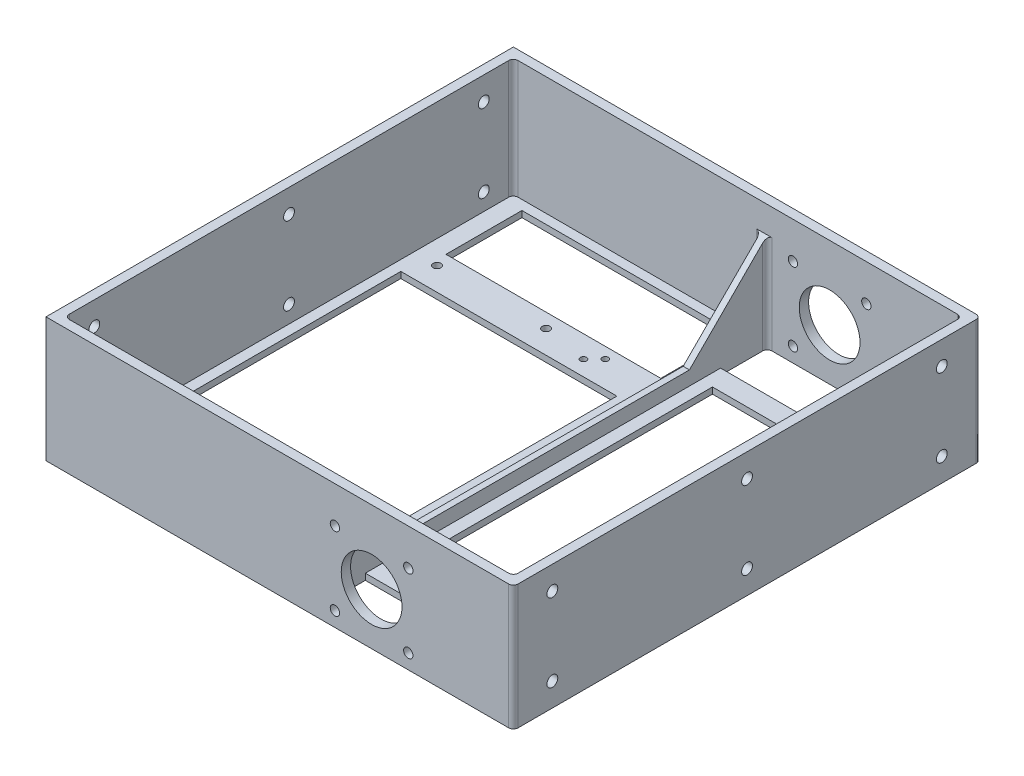
from build123d import *

# Parameters (mm, degrees)
SKETCH_1_W                = 300
SKETCH_1_H                = 300
EXTRUDE_1_DEPTH           = 4
EXTRUDE_2_DEPTH           = 76
FILLET_1_R                = 3
CUT_EXTRUDE_1_DEPTH       = 345.818792991
CUT_EXTRUDE_1_DEPTH_BACK  = 345.818792991
SKETCH_3_R                = 3
SKETCH_3_R_2              = 19.5
SKETCH_4_W                = 6
SKETCH_4_H                = 300
EXTRUDE_3_DEPTH           = 76
SKETCH_7_R                = 2
CUT_EXTRUDE_3_DEPTH       = 10
SKETCH_14_W               = 80
SKETCH_14_H               = 30
CUT_EXTRUDE_9_DEPTH       = 20
CUT_EXTRUDE_10_DEPTH      = 345.818792991
CUT_EXTRUDE_10_DEPTH_BACK = 345.818792991
SKETCH_15_R               = 3.5
SKETCH_16_W               = 4
SKETCH_16_H               = 288
EXTRUDE_5_DEPTH           = 9
CHAMFER_3_SIZE            = 50
SKETCH_17_R               = 2.25
SKETCH_17_R_2             = 2.5
CUT_EXTRUDE_11_DEPTH      = 6
SKETCH_18_W               = 137.872576177
SKETCH_18_H               = 47.95567867
SKETCH_18_W_2             = 92.314681441
SKETCH_18_H_2             = 203.212188366
SKETCH_18_W_3             = 138.671837489
SKETCH_18_H_3             = 133.676454294
SKETCH_18_H_4             = 48.754939981
CUT_EXTRUDE_12_DEPTH      = 6
FILLET_4_R                = 3


with BuildPart() as part:
    # Эскиз1 → Бобышка-Вытянуть1 (new body)
    with BuildSketch(Plane(origin=(0, 0, 0), x_dir=(1, 0, 0), z_dir=(0, 1, 0))):
        Rectangle(SKETCH_1_W, SKETCH_1_H)
    extrude(amount=EXTRUDE_1_DEPTH)

    # Эскиз2 → Бобышка-Вытянуть2 (add)
    with BuildSketch(Plane(origin=(0, 4, 0), x_dir=(1, 0, 0), z_dir=(0, 1, 0))):
        Polygon((150, 150), (-144, 150), (-144, 144), (144, 144), (144, -144), (-144, -144), (-144, -150), (150, -150), (150, 0.239524614), align=None)
    extrude(amount=EXTRUDE_2_DEPTH)

    # Скругление1
    fillet_1_edges = [part.edges().sort_by_distance(p)[0] for p in [
        (150, 40, 150),
        (150, 40, -150),
    ]]
    fillet(fillet_1_edges, radius=FILLET_1_R)

    # Эскиз3 → Вырез-Вытянуть1 (cut, two sides: drawn at the far end of the back side and taken through both)
    with BuildSketch(Plane.XY.offset(150).offset(-CUT_EXTRUDE_1_DEPTH_BACK)):
        with Locations((35.45, 56.55)):
            Circle(SKETCH_3_R)
        with Locations((82.55, 56.55)):
            Circle(SKETCH_3_R)
        with Locations((35.45, 9.45)):
            Circle(SKETCH_3_R)
        with Locations((82.55, 9.45)):
            Circle(SKETCH_3_R)
        with Locations((59, 33)):
            Circle(SKETCH_3_R_2)
    extrude(amount=CUT_EXTRUDE_1_DEPTH + CUT_EXTRUDE_1_DEPTH_BACK, mode=Mode.SUBTRACT)

    # Эскиз4 → Бобышка-Вытянуть3 (add)
    with BuildSketch(Plane(origin=(0, 4, 0), x_dir=(1, 0, 0), z_dir=(0, 1, 0))):
        with Locations((-147, 0)):
            Rectangle(SKETCH_4_W, SKETCH_4_H)
    extrude(amount=EXTRUDE_3_DEPTH)

    # Эскиз7 → Вырез-Вытянуть3 (cut)
    with BuildSketch(Plane(origin=(0, 4, 0), x_dir=(1, 0, 0), z_dir=(0, 1, 0))):
        with Locations(Location((127, 82, 0), (0, 0, 270))):
            Circle(SKETCH_7_R)
        with Locations(Location((134, 75, 0), (0, 0, 270))):
            Circle(SKETCH_7_R)
        with Locations(Location((-23, 82, 0), (0, 0, 270))):
            Circle(SKETCH_7_R)
        with Locations(Location((-30, 75, 0), (0, 0, 270))):
            Circle(SKETCH_7_R)
        with Locations(Location((127, -82, 0), (0, 0, 270))):
            Circle(SKETCH_7_R)
        with Locations(Location((134, -75, 0), (0, 0, 270))):
            Circle(SKETCH_7_R)
        with Locations(Location((-30, -75, 0), (0, 0, 270))):
            Circle(SKETCH_7_R)
        with Locations(Location((-23, -82, 0), (0, 0, 270))):
            Circle(SKETCH_7_R)
    extrude(amount=-CUT_EXTRUDE_3_DEPTH, mode=Mode.SUBTRACT)

    # Эскиз14 → Вырез-Вытянуть9 (cut)
    with BuildSketch(Plane(origin=(0, 4, 0), x_dir=(1, 0, 0), z_dir=(0, 1, 0))):
        with Locations((59, 129)):
            Rectangle(SKETCH_14_W, SKETCH_14_H)
        with Locations((59, -129)):
            Rectangle(SKETCH_14_W, SKETCH_14_H)
    extrude(amount=-CUT_EXTRUDE_9_DEPTH, mode=Mode.SUBTRACT)

    # Эскиз15 → Вырез-Вытянуть10 (cut, two sides: drawn at the far end of the back side and taken through both)
    with BuildSketch(Plane.ZY.offset(150).offset(-CUT_EXTRUDE_10_DEPTH_BACK)):
        with Locations((0, 65)):
            Circle(SKETCH_15_R)
        with Locations((125, 65)):
            Circle(SKETCH_15_R)
        with Locations((-125, 65)):
            Circle(SKETCH_15_R)
        with Locations((-125, 15)):
            Circle(SKETCH_15_R)
        with Locations((125, 15)):
            Circle(SKETCH_15_R)
        with Locations((0, 15)):
            Circle(SKETCH_15_R)
    extrude(amount=CUT_EXTRUDE_10_DEPTH + CUT_EXTRUDE_10_DEPTH_BACK, mode=Mode.SUBTRACT)

    # Эскиз16 → Бобышка-Вытянуть5 (add)
    with BuildSketch(Plane(origin=(0, 4, 0), x_dir=(1, 0, 0), z_dir=(0, 1, 0))):
        with Locations((17, 0)):
            Rectangle(SKETCH_16_W, SKETCH_16_H)
    extrude(amount=EXTRUDE_5_DEPTH)

    # Фаска3
    chamfer_3_edges = [part.edges().sort_by_distance(p)[0] for p in [
        (17, 13, -144),
        (17, 13, 144),
    ]]
    chamfer(chamfer_3_edges, length=CHAMFER_3_SIZE)

    # Эскиз17 → Вырез-Вытянуть11 (cut)
    with BuildSketch(Plane(origin=(0, 4, 0), x_dir=(1, 0, 0), z_dir=(0, 1, 0))):
        with Locations(Location((0, 134, 0), (0, 0, 270))):
            Circle(SKETCH_17_R)
        with Locations(Location((0, 104, 0), (0, 0, 270))):
            Circle(SKETCH_17_R)
        with Locations(Location((-64, 134, 0), (0, 0, 270))):
            Circle(SKETCH_17_R)
        with Locations(Location((-64, 104, 0), (0, 0, 270))):
            Circle(SKETCH_17_R)
        with Locations(Location((-128, 134, 0), (0, 0, 270))):
            Circle(SKETCH_17_R)
        with Locations(Location((-128, 104, 0), (0, 0, 270))):
            Circle(SKETCH_17_R)
        with Locations(Location((-128, -104, 0), (0, 0, 90))):
            Circle(SKETCH_17_R)
        with Locations(Location((-128, -134, 0), (0, 0, 90))):
            Circle(SKETCH_17_R)
        with Locations(Location((-64, -104, 0), (0, 0, 90))):
            Circle(SKETCH_17_R)
        with Locations(Location((-64, -134, 0), (0, 0, 90))):
            Circle(SKETCH_17_R)
        with Locations(Location((0, -104, 0), (0, 0, 90))):
            Circle(SKETCH_17_R)
        with Locations(Location((0, -134, 0), (0, 0, 90))):
            Circle(SKETCH_17_R)
        with Locations(Location((-129, 0, 0), (0, 0, 270))):
            Circle(SKETCH_17_R_2)
        with Locations(Location((-59, 0, 0), (0, 0, 270))):
            Circle(SKETCH_17_R_2)
        with Locations(Location((-59, 40, 0), (0, 0, 270))):
            Circle(SKETCH_17_R_2)
        with Locations(Location((-129, 40, 0), (0, 0, 270))):
            Circle(SKETCH_17_R_2)
        with Locations(Location((-59, 80, 0), (0, 0, 270))):
            Circle(SKETCH_17_R_2)
        with Locations(Location((-129, 80, 0), (0, 0, 270))):
            Circle(SKETCH_17_R_2)
        with Locations(Location((-59, -40, 0), (0, 0, 270))):
            Circle(SKETCH_17_R_2)
        with Locations(Location((-129, -40, 0), (0, 0, 270))):
            Circle(SKETCH_17_R_2)
        with Locations(Location((-59, -80, 0), (0, 0, 270))):
            Circle(SKETCH_17_R_2)
        with Locations(Location((-129, -80, 0), (0, 0, 270))):
            Circle(SKETCH_17_R_2)
    extrude(amount=-CUT_EXTRUDE_11_DEPTH, mode=Mode.SUBTRACT)

    # Эскиз18 → Вырез-Вытянуть12 (cut)
    with BuildSketch(Plane(origin=(0, 4, 0), x_dir=(1, 0, 0), z_dir=(0, 1, 0))):
        with Locations((-63.441366575, -113.894736842)):
            Rectangle(SKETCH_18_W, SKETCH_18_H)
        with Locations((73.032502308, -0.699353647)):
            Rectangle(SKETCH_18_W_2, SKETCH_18_H_2)
        with Locations((-68.037119113, -1.698430286)):
            Rectangle(SKETCH_18_W_3, SKETCH_18_H_3)
        with Locations((-63.441366575, 113.495106187)):
            Rectangle(SKETCH_18_W, SKETCH_18_H_4)
    extrude(amount=-CUT_EXTRUDE_12_DEPTH, mode=Mode.SUBTRACT)

    # Скругление4
    fillet_4_edges = [part.edges().sort_by_distance(p)[0] for p in [
        (-144, 42, -144),
        (19, 31.5, -144),
        (144, 42, -144),
        (144, 42, 144),
        (19, 31.5, 144),
        (-144, 42, 144),
        (15, 33.5, -144),
        (15, 33.5, 144),
    ]]
    fillet(fillet_4_edges, radius=FILLET_4_R)


solid = part.part
